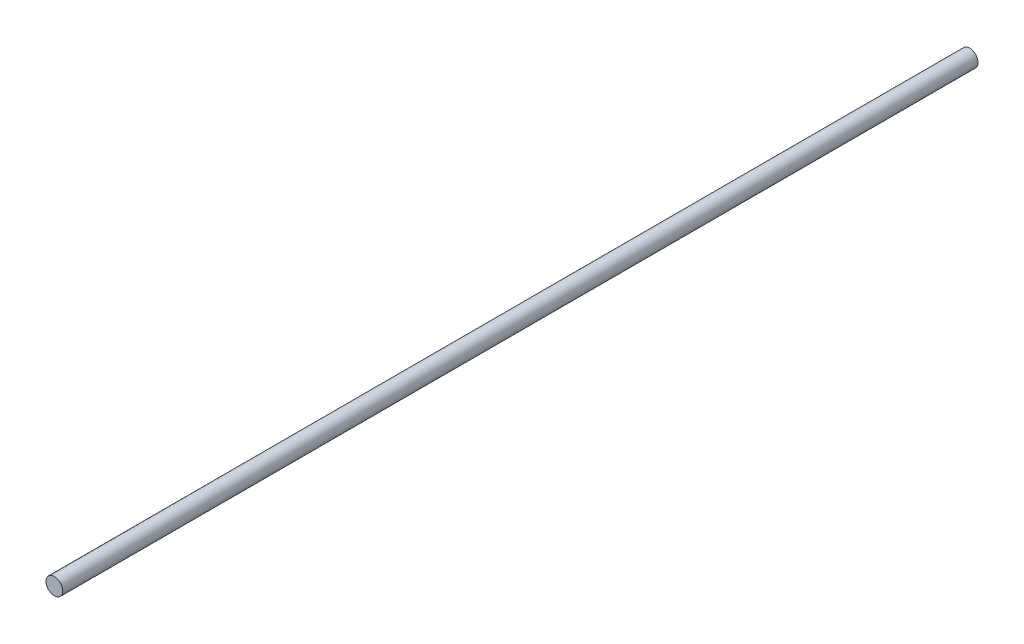
from build123d import *

# Parameters (mm, degrees)
SKETCH_1_R      = 2.75
EXTRUDE_1_DEPTH = 300


with BuildPart() as part:
    # ｽｹｯﾁ1 → ﾎﾞｽ - 押し出し1 (new body)
    with BuildSketch(Plane.XY):
        Circle(SKETCH_1_R)
    extrude(amount=EXTRUDE_1_DEPTH)


solid = part.part
